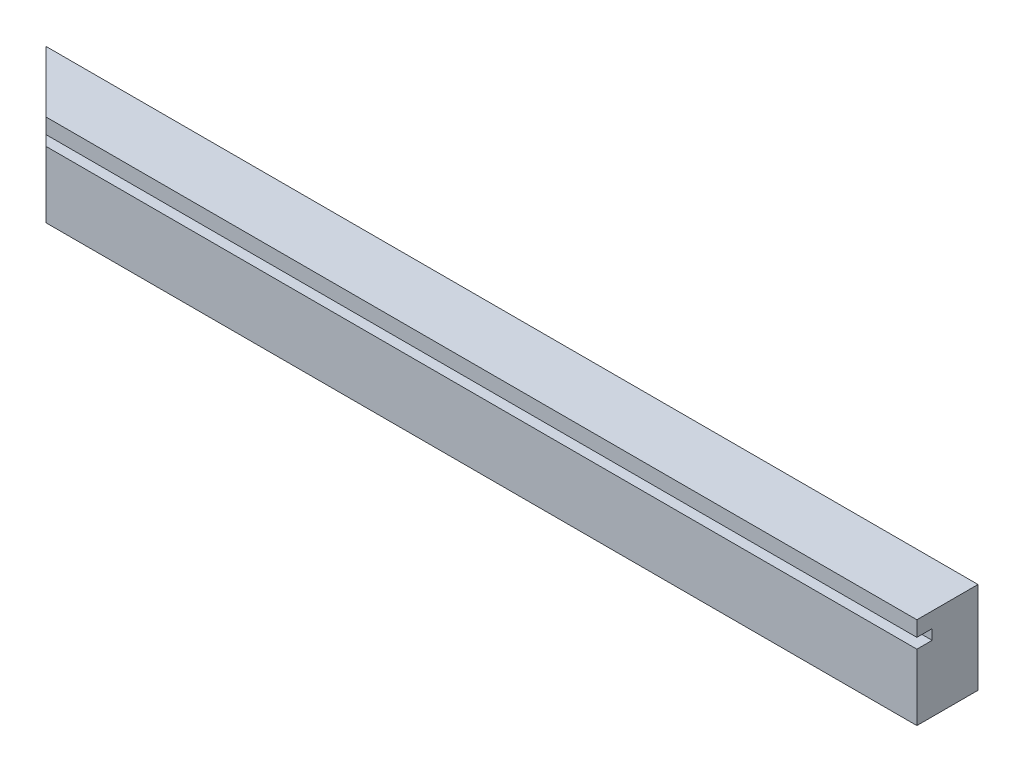
from build123d import *

# Parameters (mm, degrees)
BOSS_EXTRUDE1_DEPTH = 18
SKETCH2_W           = 3
SKETCH2_H           = 2
CUT_EXTRUDE1_DEPTH  = 185.274252135
SKETCH3_W           = 183
SKETCH3_H           = 18
CUT_EXTRUDE2_DEPTH  = 12


with BuildPart() as part:
    # Sketch1 → Boss-Extrude1 (new body)
    with BuildSketch(Plane(origin=(0, 0, 0), x_dir=(1, 0, 0), z_dir=(0, 1, 0))):
        Polygon((183, 0), (0, 0), (12, 12), (183, 12), align=None)
    boss_extrude1 = extrude(amount=BOSS_EXTRUDE1_DEPTH)

    # Sketch2 → Cut-Extrude1 (cut, symmetric)
    with BuildSketch(Plane(origin=(183, 0, 0), x_dir=(0, 0, -1), z_dir=(1, 0, 0))):
        with Locations((10.5, 14)):
            Rectangle(SKETCH2_W, SKETCH2_H)
    cut_extrude1 = extrude(amount=CUT_EXTRUDE1_DEPTH, both=True, mode=Mode.SUBTRACT)

    # Mirror2: Boss-Extrude1, Cut-Extrude1 across plane
    add(boss_extrude1.mirror(Plane(origin=(0, 18, -12), x_dir=(1, 0, 0), z_dir=(0, 0, -1))))
    add(cut_extrude1.mirror(Plane(origin=(0, 18, -12), x_dir=(1, 0, 0), z_dir=(0, 0, -1))), mode=Mode.SUBTRACT)

    # Sketch3 → Cut-Extrude2 (cut)
    with BuildSketch(Plane.XY):
        with Locations((91.5, 9)):
            Rectangle(SKETCH3_W, SKETCH3_H)
    extrude(amount=-CUT_EXTRUDE2_DEPTH, mode=Mode.SUBTRACT)


solid = part.part
